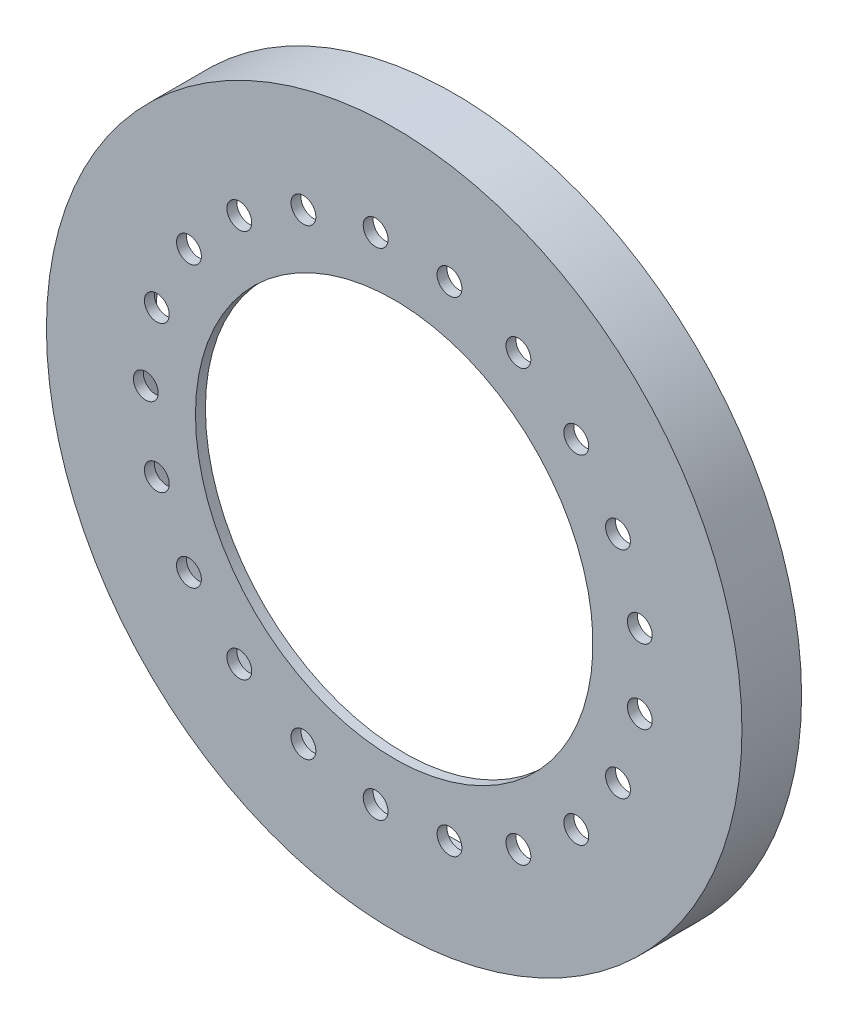
from build123d import *

# Parameters (mm, degrees)
SKETCH3_R           = 88.9
BOSS_EXTRUDE2_DEPTH = 15.24
SKETCH1_R           = 76.2
SKETCH1_R_2         = 50.8
CUT_EXTRUDE1_DEPTH  = 12.7
SKETCH4_R           = 3.175
SKETCH4_R_2         = 50.8
CUT_EXTRUDE3_DEPTH  = 127.643900761


with BuildPart() as part:
    # Sketch3 → Boss-Extrude2 (new body)
    with BuildSketch(Plane.XY):
        with Locations(Location((0, 0, 0), (0, 0, 180))):
            Circle(SKETCH3_R)
    extrude(amount=BOSS_EXTRUDE2_DEPTH)

    # Sketch1 → Cut-Extrude1 (cut)
    with BuildSketch(Plane.XY):
        Circle(SKETCH1_R)
        Circle(SKETCH1_R_2, mode=Mode.SUBTRACT)
    extrude(amount=CUT_EXTRUDE1_DEPTH, mode=Mode.SUBTRACT)

    # Sketch4 → Cut-Extrude3 (cut, through all)
    with BuildSketch(Plane.XY):
        with Locations(Location((-63.5, 0, 0), (0, 0, 180))):
            Circle(SKETCH4_R)
        with Locations(Location((0, 0, 0), (0, 0, 180))):
            Circle(SKETCH4_R_2)
        with Locations(Location((-60.678873167, 18.716953575, 0), (0, 0, 180))):
            Circle(SKETCH4_R)
        with Locations(Location((-52.466162169, 35.770823687, 0), (0, 0, 180))):
            Circle(SKETCH4_R)
        with Locations(Location((-39.591602418, 49.646299137, 0), (0, 0, 180))):
            Circle(SKETCH4_R)
        with Locations(Location((-23.199155047, 59.110483039, 0), (0, 0, 180))):
            Circle(SKETCH4_R)
        with Locations(Location((-4.745360943, 63.322441121, 0), (0, 0, 180))):
            Circle(SKETCH4_R)
        with Locations(Location((14.130079306, 61.907922424, 0), (0, 0, 180))):
            Circle(SKETCH4_R)
        with Locations(Location((31.75, 54.99261314, 0), (0, 0, 180))):
            Circle(SKETCH4_R)
        with Locations(Location((46.548793861, 43.190968848, 0), (0, 0, 180))):
            Circle(SKETCH4_R)
        with Locations(Location((57.211523112, 27.551617434, 0), (0, 0, 180))):
            Circle(SKETCH4_R)
        with Locations(Location((62.790757465, 9.464183902, 0), (0, 0, 180))):
            Circle(SKETCH4_R)
        with Locations(Location((62.790757465, -9.464183902, 0), (0, 0, 180))):
            Circle(SKETCH4_R)
        with Locations(Location((57.211523112, -27.551617434, 0), (0, 0, 180))):
            Circle(SKETCH4_R)
        with Locations(Location((46.548793861, -43.190968848, 0), (0, 0, 180))):
            Circle(SKETCH4_R)
        with Locations(Location((31.75, -54.99261314, 0), (0, 0, 180))):
            Circle(SKETCH4_R)
        with Locations(Location((14.130079306, -61.907922424, 0), (0, 0, 180))):
            Circle(SKETCH4_R)
        with Locations(Location((-4.745360943, -63.322441121, 0), (0, 0, 180))):
            Circle(SKETCH4_R)
        with Locations(Location((-23.199155047, -59.110483039, 0), (0, 0, 180))):
            Circle(SKETCH4_R)
        with Locations(Location((-39.591602418, -49.646299137, 0), (0, 0, 180))):
            Circle(SKETCH4_R)
        with Locations(Location((-52.466162169, -35.770823687, 0), (0, 0, 180))):
            Circle(SKETCH4_R)
        with Locations(Location((-60.678873167, -18.716953575, 0), (0, 0, 180))):
            Circle(SKETCH4_R)
    extrude(amount=CUT_EXTRUDE3_DEPTH, mode=Mode.SUBTRACT)


solid = part.part
